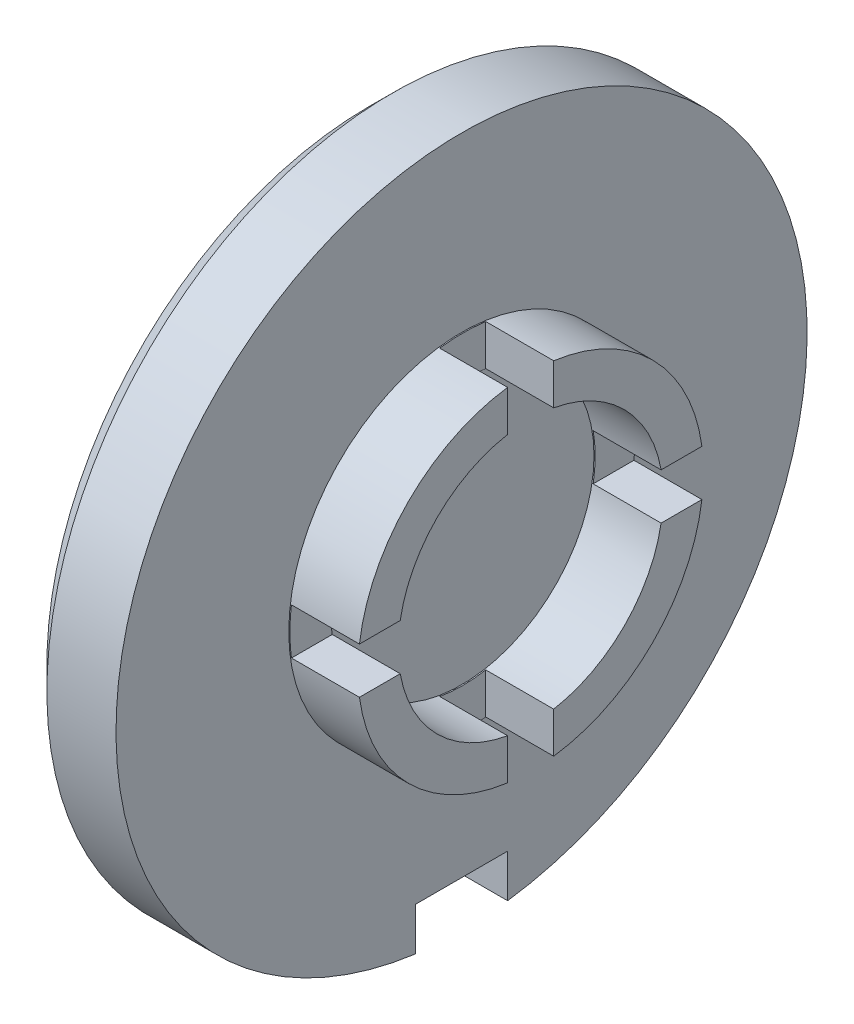
from build123d import *

# Parameters (mm, degrees)
BOSS_EXTRUDE1_START = 62.8
SKETCH2_W           = 1.28
SKETCH2_H           = 0.8
BOSS_EXTRUDE1_DEPTH = 6.4
BOSS_EXTRUDE2_START = 65.6
SKETCH3_W           = 1.28
SKETCH3_H           = 6.4
BOSS_EXTRUDE2_DEPTH = 0.8
BOSS_EXTRUDE3_START = 65.2
SKETCH4_W           = 1.8
SKETCH4_H           = 0.9
BOSS_EXTRUDE3_DEPTH = 1.6


with BuildPart() as part:
    # Sketch1 → Revolve1 (revolve)
    with BuildSketch(Plane.XY.offset(66)):
        Polygon((-74, -17.7), (-75.2, -17.7), (-75.2, -20), (-76.8, -20), (-76.8, -14.4), (-76.4, -14), (-75.2, -14), (-75.2, -17), (-74, -17), align=None)
    revolve(axis=Axis((-81.8, -20, 66), (1, 0, 0)))


with BuildPart() as body_2:
    # Sketch2 → Boss-Extrude1 (new body)
    with BuildSketch(Plane.XY.offset(BOSS_EXTRUDE1_START)):
        with Locations((-74.54, -20)):
            Rectangle(SKETCH2_W, SKETCH2_H)
    extrude(amount=BOSS_EXTRUDE1_DEPTH)


with BuildPart() as part_1:
    add(part.part)

    # Combine1: cut body 2
    add(body_2.part, mode=Mode.SUBTRACT)


with BuildPart() as body_2_2:
    # Sketch3 → Boss-Extrude2 (new body)
    with BuildSketch(Plane.XY.offset(BOSS_EXTRUDE2_START)):
        with Locations((-74.54, -20)):
            Rectangle(SKETCH3_W, SKETCH3_H)
    extrude(amount=BOSS_EXTRUDE2_DEPTH)


with BuildPart() as part_2:
    add(part_1.part)

    # Combine2: cut body 2 2
    add(body_2_2.part, mode=Mode.SUBTRACT)


with BuildPart() as body_2_3:
    # Sketch4 → Boss-Extrude3 (new body)
    with BuildSketch(Plane.XY.offset(BOSS_EXTRUDE3_START)):
        with Locations((-76, -25.65)):
            Rectangle(SKETCH4_W, SKETCH4_H)
    extrude(amount=BOSS_EXTRUDE3_DEPTH)


with BuildPart() as part_3:
    add(part_2.part)

    # Combine3: cut body 2 3
    add(body_2_3.part, mode=Mode.SUBTRACT)


solid = part_3.part
